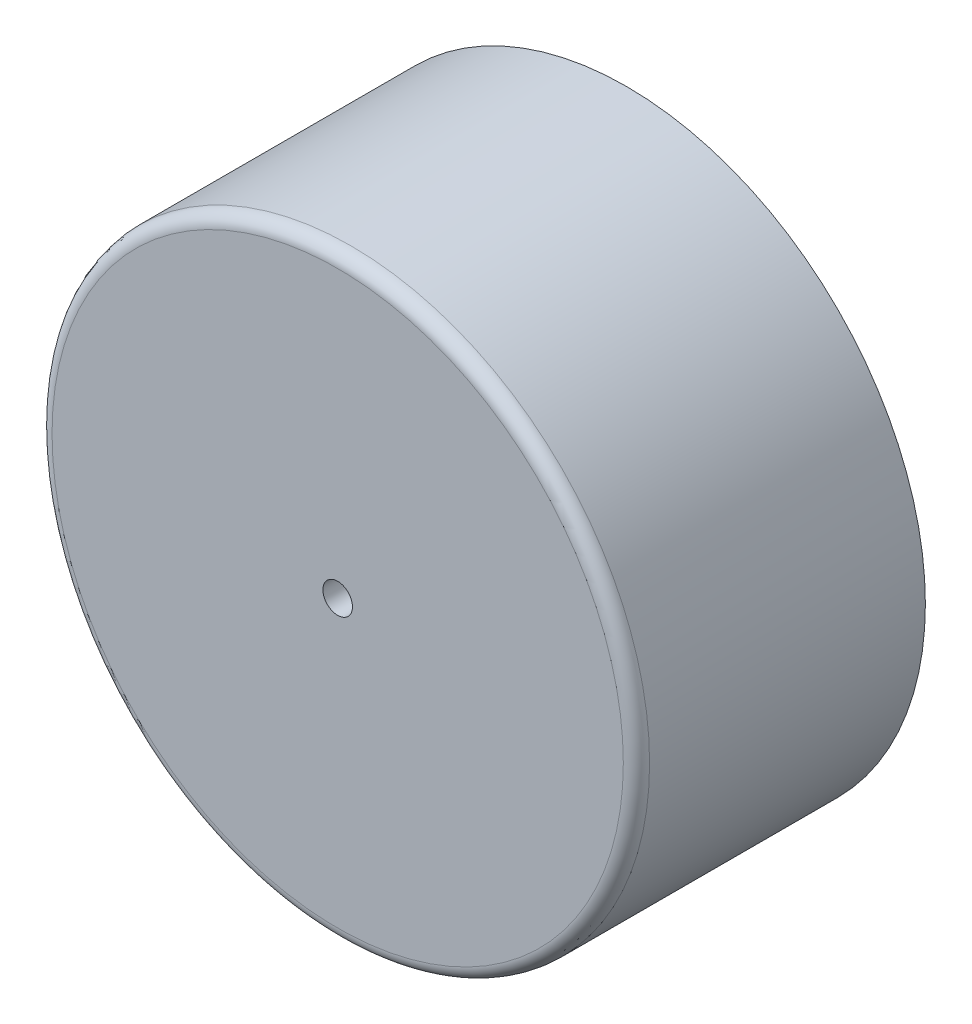
from build123d import *

# Parameters (mm, degrees)
SKETCH1_R           = 22.75
BOSS_EXTRUDE1_DEPTH = 2
BOSS_EXTRUDE2_START = 20
SKETCH2_R           = 22.75
SKETCH2_R_2         = 20.75
BOSS_EXTRUDE2_DEPTH = 20
FILLET1_R           = 1
SKETCH3_R           = 1.125
CUT_EXTRUDE1_DEPTH  = 20


with BuildPart() as part:
    # Sketch1 → Boss-Extrude1 (new body)
    with BuildSketch(Plane.XY):
        Circle(SKETCH1_R)
    extrude(amount=BOSS_EXTRUDE1_DEPTH)

    # Sketch2 → Boss-Extrude2 (add)
    with BuildSketch(Plane(origin=(0, 0, 0), x_dir=(-1, 0, 0), z_dir=(0, 0, -1)).offset(BOSS_EXTRUDE2_START)):
        Circle(SKETCH2_R)
        Circle(SKETCH2_R_2, mode=Mode.SUBTRACT)
    extrude(amount=-BOSS_EXTRUDE2_DEPTH)

    # Fillet1
    fillet1_edges = [part.edges().sort_by_distance(p)[0] for p in [
        (-22.75, 0, 2),
    ]]
    fillet(fillet1_edges, radius=FILLET1_R)

    # Sketch3 → Cut-Extrude1 (cut)
    with BuildSketch(Plane.XY.offset(2)):
        Circle(SKETCH3_R)
    extrude(amount=-CUT_EXTRUDE1_DEPTH, mode=Mode.SUBTRACT)


solid = part.part
